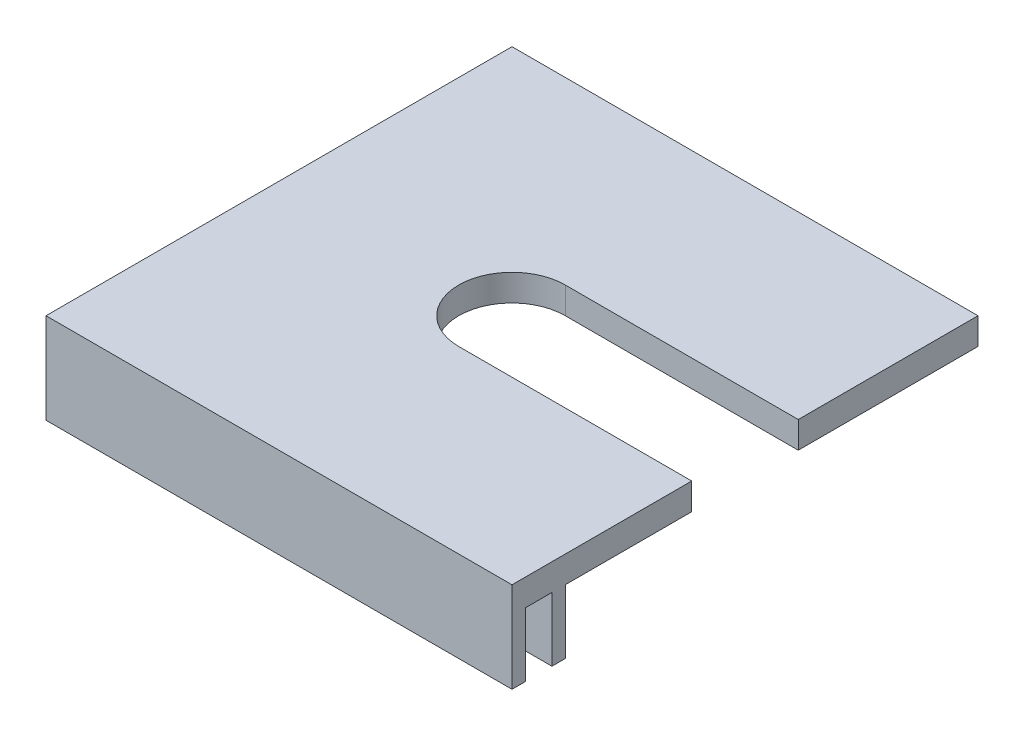
from build123d import *

# Parameters (mm, degrees)
BOSS_EXTRUDE1_DEPTH = 2
BOSS_EXTRUDE2_DEPTH = 5
CHAMFER1_SIZE       = 0.2


with BuildPart() as part:
    # Sketch1 → Boss-Extrude1 (new body)
    with BuildSketch(Plane(origin=(0, 0, 0), x_dir=(1, 0, 0), z_dir=(0, 1, 0))):
        with BuildLine():
            Line((35, 13.5), (17.5, 13.5))
            ThreePointArc((17.5, 13.5), (13.5, 17.5), (17.5, 21.5))
            Line((17.5, 21.5), (35, 21.5))
            Line((35, 21.5), (35, 35))
            Line((35, 35), (0, 35))
            Line((0, 35), (0, 0))
            Line((0, 0), (35, 0))
            Line((35, 0), (35, 13.5))
        make_face()
    extrude(amount=BOSS_EXTRUDE1_DEPTH)

    # Sketch2 → Boss-Extrude2 (add)
    with BuildSketch(Plane.XZ):
        Polygon((35, -4), (35, -3), (3, -3), (3, -35), (4, -35), (4, -4), align=None)
        Polygon((35, -1), (35, 0), (0, 0), (0, -35), (1, -35), (1, -3), (1, -1), (3, -1), align=None)
    extrude(amount=BOSS_EXTRUDE2_DEPTH)

    # Chamfer1
    chamfer1_edges = [part.edges().sort_by_distance(p)[0] for p in [
        (19, -5, -3),
        (3, -5, -19),
        (3.5, -5, -35),
        (4, -5, -19.5),
        (19.5, -5, -4),
        (35, -5, -3.5),
        (1, -5, -18),
        (18, -5, -1),
        (35, -5, -0.5),
        (17.5, -5, 0),
        (0, -5, -17.5),
        (0.5, -5, -35),
    ]]
    chamfer(chamfer1_edges, length=CHAMFER1_SIZE)


solid = part.part
